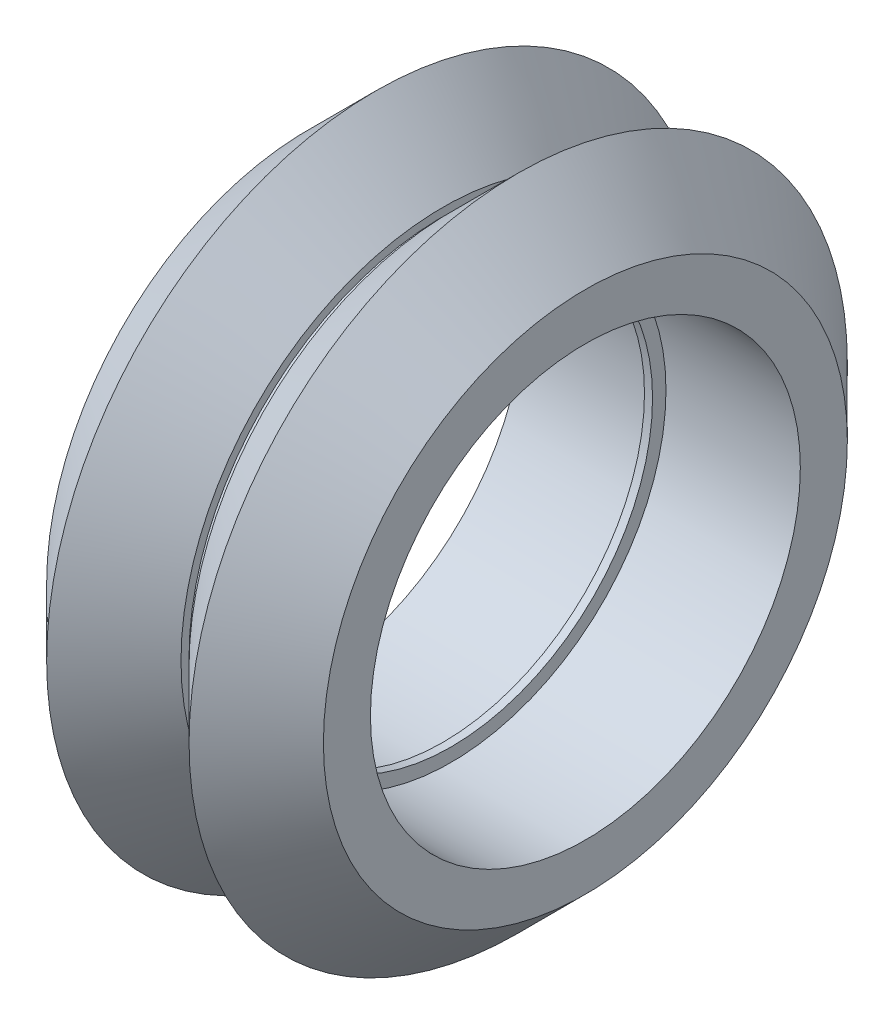
from build123d import *

# Parameters (mm, degrees)
ESBO_O2_R             = 8
CORTE_EXTRUS_O1_DEPTH = 5
CORTE_EXTRUS_O2_START = -5
ESBO_O3_R             = 8
CORTE_EXTRUS_O2_DEPTH = 5
ESBO_O4_R             = 7.5
CORTE_EXTRUS_O3_DEPTH = 0.3


with BuildPart() as part:
    # Esboço1 → Revolução1 (revolve)
    with BuildSketch(Plane.XY, mode=Mode.PRIVATE) as revolu_o1_sk:
        Polygon((-5.15, 2.5), (-5.15, 9.75), (-2.65, 12.25), (-0.15, 9.75), (-0.15, 9.45), (0.15, 9.45), (0.15, 9.75), (2.65, 12.25), (5.15, 9.75), (5.15, 2.5), align=None)
    revolve(revolu_o1_sk.sketch.rotate(Axis((-5.77388535, 0, 0), (1, 0, 0)), 90), axis=Axis((-5.77388535, 0, 0), (1, 0, 0)))

    # Esboço2 → Corte-extrusão1 (cut)
    with BuildSketch(Plane(origin=(5.15, 0, 0), x_dir=(0, 0, -1), z_dir=(1, 0, 0))):
        Circle(ESBO_O2_R)
    extrude(amount=-CORTE_EXTRUS_O1_DEPTH, mode=Mode.SUBTRACT)

    # Esboço3 → Corte-extrusão2 (cut)
    with BuildSketch(Plane.ZY.offset(5.15).offset(CORTE_EXTRUS_O2_START)):
        with Locations(Location((0, 0, 0), (0, 0, 180))):
            Circle(ESBO_O3_R)
    extrude(amount=CORTE_EXTRUS_O2_DEPTH, mode=Mode.SUBTRACT)

    # Esboço4 → Corte-extrusão3 (cut)
    with BuildSketch(Plane.ZY.offset(0.15)):
        Circle(ESBO_O4_R)
    extrude(amount=-CORTE_EXTRUS_O3_DEPTH, mode=Mode.SUBTRACT)


solid = part.part
